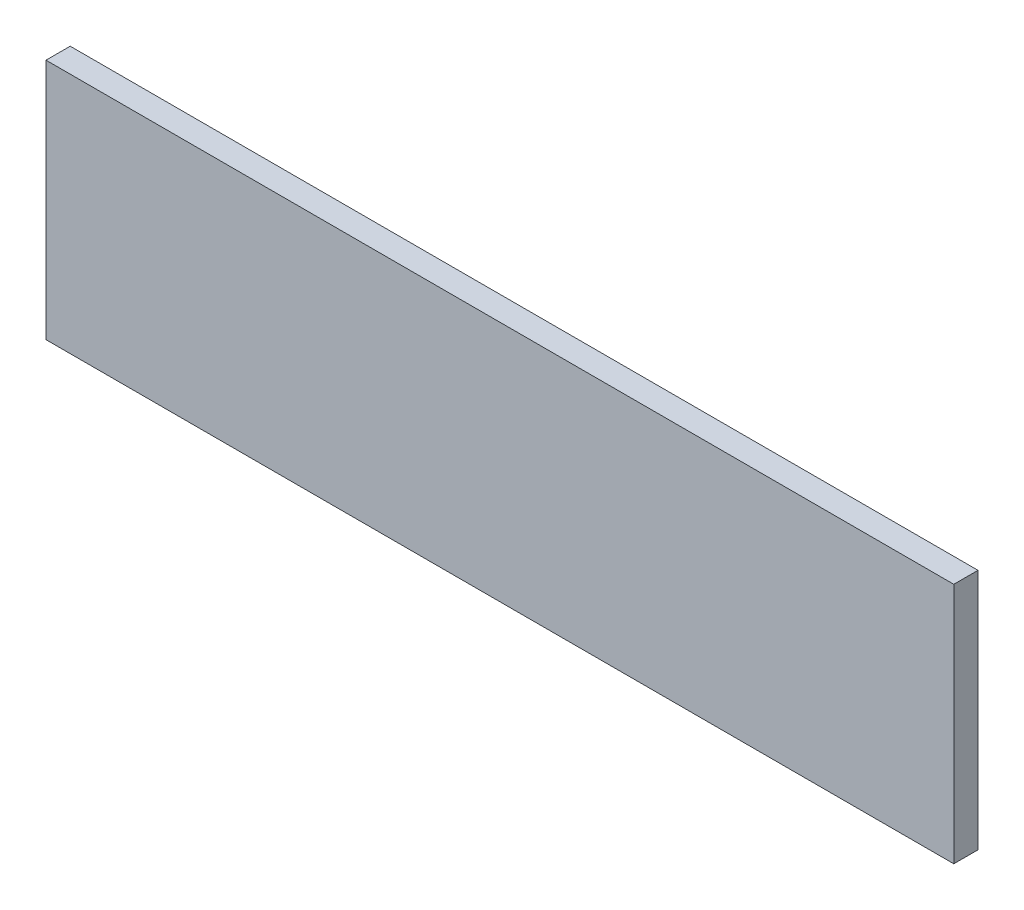
from build123d import *

# Parameters (mm, degrees)
SKETCH1_W           = 190.5
SKETCH1_H           = 50.8
BOSS_EXTRUDE1_DEPTH = 5.08


with BuildPart() as part:
    # Sketch1 → Boss-Extrude1 (new body)
    with BuildSketch(Plane.XY):
        with Locations((1.109398839, -3.653036721)):
            Rectangle(SKETCH1_W, SKETCH1_H)
    extrude(amount=BOSS_EXTRUDE1_DEPTH)


solid = part.part
